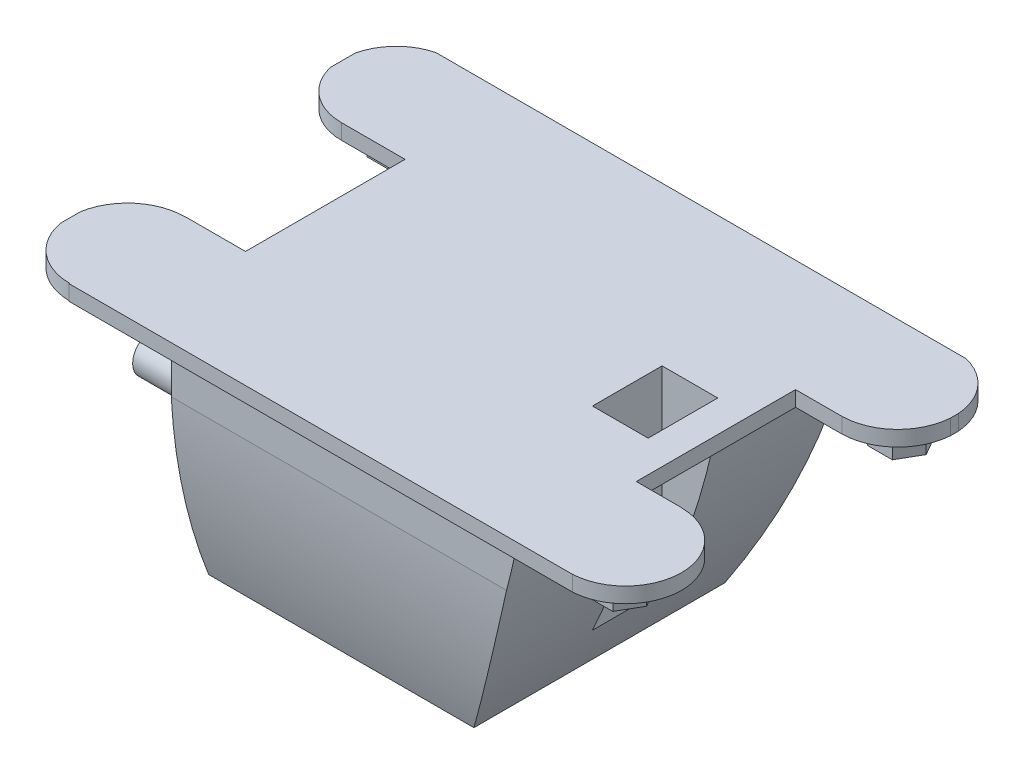
from build123d import *

# Parameters (mm, degrees)
SKETCH2_W            = 40
SKETCH2_H            = 25
BOSS_EXTRUDE2_DEPTH  = 1
CUT_EXTRUDE1_DEPTH   = 24.606143268
SKETCH5_W            = 3.048166118
SKETCH5_H            = 10.380355358
CUT_EXTRUDE4_DEPTH   = 1
CUT_EXTRUDE5_DEPTH   = 24.606143268
SKETCH7_W            = 4.145565418
SKETCH7_H            = 10.399948371
CUT_EXTRUDE7_DEPTH   = 24.606143268
SKETCH8_W            = 22.680519054
SKETCH8_H            = 21.612113122
BOSS_EXTRUDE3_DEPTH  = 15
CUT_EXTRUDE8_DEPTH   = 30
CUT_EXTRUDE9_DEPTH   = 30
CUT_EXTRUDE10_DEPTH  = 30
SKETCH12_W           = 3.628157273
SKETCH12_H           = 4.536406583
CUT_EXTRUDE11_DEPTH  = 29.500000056
BOSS_EXTRUDE4_DEPTH  = 2
BOSS_EXTRUDE5_DEPTH  = 2
BOSS_EXTRUDE6_DEPTH  = 2
BOSS_EXTRUDE7_DEPTH  = 2
SKETCH17_R           = 3.503719222
BOSS_EXTRUDE8_DEPTH  = 0.5
BOSS_EXTRUDE9_DEPTH  = 2
BOSS_EXTRUDE10_DEPTH = 2
SKETCH20_R           = 1.26687785
BOSS_EXTRUDE11_DEPTH = 4
SKETCH21_R           = 1.46158904
BOSS_EXTRUDE12_DEPTH = 4


with BuildPart() as part:
    # Sketch2 → Boss-Extrude2 (new body)
    with BuildSketch(Plane(origin=(0, 0, 0), x_dir=(1, 0, 0), z_dir=(0, 1, 0))):
        Rectangle(SKETCH2_W, SKETCH2_H)
    extrude(amount=BOSS_EXTRUDE2_DEPTH)

    # Sketch4 → Cut-Extrude1 (cut, through all)
    with BuildSketch(Plane(origin=(0, 0, 0), x_dir=(-1, 0, 0), z_dir=(0, -1, 0))):
        with BuildLine():
            Line((-16.311436799, -5.195321305), (-16.311436799, 5.197856111))
            ThreePointArc((-16.311436799, 5.197856111), (-20.005849228, 9.049958295), (-16.002782134, 12.580231412))
            Line((-16.002782134, 12.580231412), (-16.034433084, 14.57463247))
            Line((-16.034433084, 14.57463247), (-22.167227524, 14.47730562))
            Line((-22.167227524, 14.47730562), (-21.947479334, -14.537250164))
            Line((-21.947479334, -14.537250164), (-16.200353352, -14.798286616))
            Line((-16.200353352, -14.798286616), (-16.311436799, -12.504458481))
            ThreePointArc((-16.311436799, -12.504458481), (-19.966005387, -8.849889893), (-16.311436799, -5.195321305))
        make_face()
    extrude(amount=-CUT_EXTRUDE1_DEPTH, mode=Mode.SUBTRACT)

    # Sketch5 → Cut-Extrude4 (cut)
    with BuildSketch(Plane(origin=(0, 0, 0), x_dir=(-1, 0, 0), z_dir=(0, -1, 0))):
        with Locations((-14.87035518, 0.008277846)):
            Rectangle(SKETCH5_W, SKETCH5_H)
    extrude(amount=-CUT_EXTRUDE4_DEPTH, mode=Mode.SUBTRACT)

    # Sketch6 → Cut-Extrude5 (cut, through all)
    with BuildSketch(Plane(origin=(0, 0, 0), x_dir=(-1, 0, 0), z_dir=(0, -1, 0))):
        with BuildLine():
            Line((16.521680561, 5.46762026), (16.29742638, -4.945125741))
            ThreePointArc((16.29742638, -4.945125741), (20.054665472, -8.702364833), (16.29742638, -12.459603925))
            Line((16.29742638, -12.459603925), (16.29742638, -15.143532095))
            Line((16.29742638, -15.143532095), (29.009035652, -15.661685945))
            Line((29.009035652, -15.661685945), (29.009035652, -13.80156801))
            Line((29.009035652, -13.80156801), (27.951962111, 14.649001906))
            Line((27.951962111, 14.649001906), (18.760629252, 18.072251543))
            Line((18.760629252, 18.072251543), (16.723599762, 12.602882354))
            ThreePointArc((16.723599762, 12.602882354), (20.090739839, 8.937108322), (16.521680561, 5.46762026))
        make_face()
    extrude(amount=-CUT_EXTRUDE5_DEPTH, mode=Mode.SUBTRACT)

    # Sketch7 → Cut-Extrude7 (cut, through all)
    with BuildSketch(Plane(origin=(0, 0, 0), x_dir=(-1, 0, 0), z_dir=(0, -1, 0))):
        with Locations((14.448897852, 0.267646074)):
            Rectangle(SKETCH7_W, SKETCH7_H)
    extrude(amount=-CUT_EXTRUDE7_DEPTH, mode=Mode.SUBTRACT)

    # Sketch8 → Boss-Extrude3 (add)
    with BuildSketch(Plane(origin=(0, 0, 0), x_dir=(-1, 0, 0), z_dir=(0, -1, 0))):
        Rectangle(SKETCH8_W, SKETCH8_H)
    extrude(amount=BOSS_EXTRUDE3_DEPTH)

    # Sketch9 → Cut-Extrude8 (cut)
    with BuildSketch(Plane(origin=(0, 0, -10.806056561), x_dir=(-1, 0, 0), z_dir=(0, 0, -1))):
        with BuildLine():
            Line((-11.340259527, -15), (-5.948771171, -15))
            ThreePointArc((-5.948771171, -15), (-9.260644908, -7.752061524), (-11.340259527, -0.059446699))
            Line((-11.340259527, -0.059446699), (-11.340259527, -15))
        make_face()
    extrude(amount=-CUT_EXTRUDE8_DEPTH, mode=Mode.SUBTRACT)

    # Sketch10 → Cut-Extrude9 (cut)
    with BuildSketch(Plane.ZY.offset(11.340259527)):
        with BuildLine():
            Line((-10.806056561, -15), (-7.993035408, -15))
            ThreePointArc((-7.993035408, -15), (-9.83110735, -7.639316506), (-10.806056561, -0.115511352))
            Line((-10.806056561, -0.115511352), (-10.806056561, -15))
        make_face()
    extrude(amount=-CUT_EXTRUDE9_DEPTH, mode=Mode.SUBTRACT)

    # Sketch11 → Cut-Extrude10 (cut)
    with BuildSketch(Plane.ZY.offset(11.340259527)):
        with BuildLine():
            ThreePointArc((10.806056561, -3.748163783), (10.041226218, -9.472321419), (8.369186868, -15))
            Line((8.369186868, -15), (10.806056561, -15))
            Line((10.806056561, -15), (10.806056561, -3.748163783))
        make_face()
    extrude(amount=-CUT_EXTRUDE10_DEPTH, mode=Mode.SUBTRACT)

    # Sketch12 → Cut-Extrude11 (cut, through all)
    with BuildSketch(Plane(origin=(0, 1, 0), x_dir=(1, 0, 0), z_dir=(0, 1, 0))):
        with Locations((9.470946216, -0.081192325)):
            Rectangle(SKETCH12_W, SKETCH12_H)
    extrude(amount=-CUT_EXTRUDE11_DEPTH, mode=Mode.SUBTRACT)

    # Sketch13 → Boss-Extrude4 (add)
    with BuildSketch(Plane(origin=(0, 0, 0), x_dir=(-1, 0, 0), z_dir=(0, -1, 0))):
        Polygon((-14.494931401, -8.884648292), (-15.301061446, -7.488390096), (-16.913321537, -7.488390096), (-17.719451582, -8.884648292), (-16.913321537, -10.280906489), (-15.301061446, -10.280906489), align=None)
    extrude(amount=BOSS_EXTRUDE4_DEPTH)

    # Sketch14 → Boss-Extrude5 (add)
    with BuildSketch(Plane(origin=(0, 0, 0), x_dir=(-1, 0, 0), z_dir=(0, -1, 0))):
        Polygon((-15.042408021, 8.784141367), (-15.850363425, 10.183561177), (-17.466274234, 10.183561177), (-18.274229638, 8.784141367), (-17.466274234, 7.384721557), (-15.850363425, 7.384721557), align=None)
    extrude(amount=BOSS_EXTRUDE5_DEPTH)

    # Sketch15 → Boss-Extrude6 (add)
    with BuildSketch(Plane(origin=(0, 0, 0), x_dir=(-1, 0, 0), z_dir=(0, -1, 0))):
        Polygon((17.871524181, -8.889197459), (17.023921653, -7.421106816), (15.328716596, -7.421106816), (14.481114068, -8.889197459), (15.328716596, -10.357288103), (17.023921653, -10.357288103), align=None)
    extrude(amount=BOSS_EXTRUDE6_DEPTH)

    # Sketch16 → Boss-Extrude7 (add)
    with BuildSketch(Plane(origin=(0, 0, 0), x_dir=(-1, 0, 0), z_dir=(0, -1, 0))):
        Polygon((17.673273489, 8.94154839), (16.76404939, 10.516370724), (14.945601192, 10.516370724), (14.036377093, 8.94154839), (14.945601192, 7.366726055), (16.76404939, 7.366726055), align=None)
    extrude(amount=BOSS_EXTRUDE7_DEPTH)

    # Sketch17 → Boss-Extrude8 (add)
    with BuildSketch(Plane(origin=(0, -15, 0), x_dir=(-1, 0, 0), z_dir=(0, -1, 0))):
        with Locations(Location((2.881571025, 0, 0), (0, 0, 90))):
            Circle(SKETCH17_R)
    extrude(amount=BOSS_EXTRUDE8_DEPTH)

    # Sketch18 → Boss-Extrude9 (add)
    with BuildSketch(Plane.ZY.offset(11.340259527)):
        Polygon((3.659390597, -6.726148666), (4.869302964, -8.821778359), (7.2891277, -8.821778359), (8.499040067, -6.726148666), (7.2891277, -4.630518972), (4.869302964, -4.630518972), align=None)
    extrude(amount=BOSS_EXTRUDE9_DEPTH)

    # Sketch19 → Boss-Extrude10 (add)
    with BuildSketch(Plane.ZY.offset(11.340259527)):
        Polygon((-6.402752553, -6.836831629), (-5.363301958, -9.210722079), (-2.787727224, -9.497476683), (-1.251603086, -7.410340836), (-2.291053681, -5.036450385), (-4.866628415, -4.749695782), align=None)
    extrude(amount=BOSS_EXTRUDE10_DEPTH)

    # Sketch20 → Boss-Extrude11 (add)
    with BuildSketch(Plane.ZY.offset(13.340259527)):
        with Locations((6.055236467, -6.614121956)):
            Circle(SKETCH20_R)
    extrude(amount=BOSS_EXTRUDE11_DEPTH)

    # Sketch21 → Boss-Extrude12 (add)
    with BuildSketch(Plane.ZY.offset(13.340259527)):
        with Locations((-3.88229524, -7.020150319)):
            Circle(SKETCH21_R)
    extrude(amount=BOSS_EXTRUDE12_DEPTH)


solid = part.part
